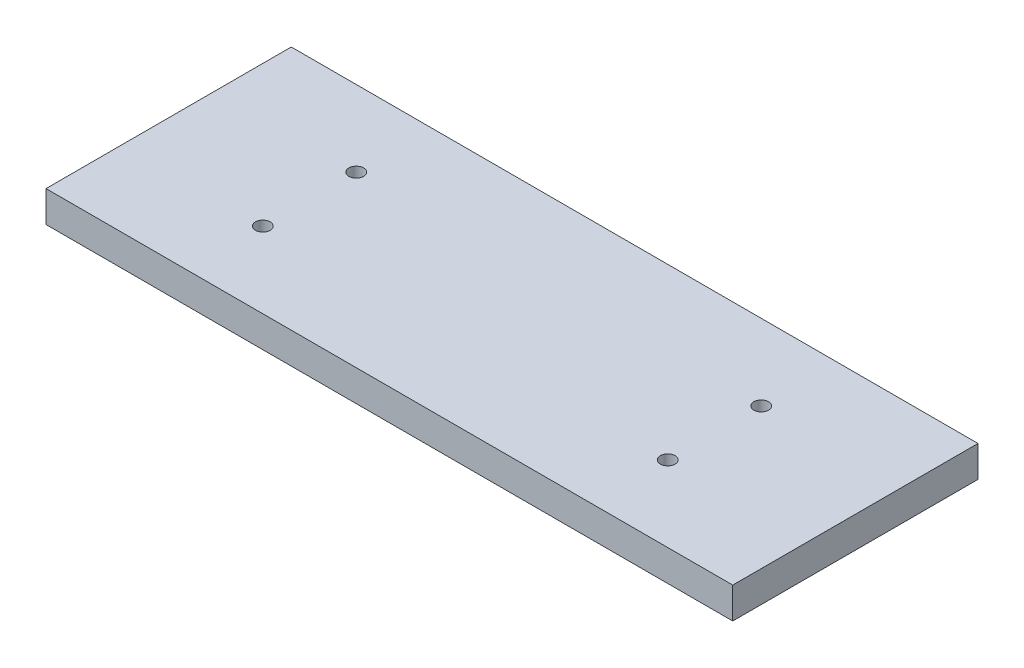
from build123d import *

# Parameters (mm, degrees)
SKETCH1_W           = 140
SKETCH1_H           = 50
BOSS_EXTRUDE1_DEPTH = 6.35
SKETCH2_R           = 1.5
CUT_EXTRUDE1_DEPTH  = 6.35


with BuildPart() as part:
    # Sketch1 → Boss-Extrude1 (new body)
    with BuildSketch(Plane(origin=(0, 0, 0), x_dir=(1, 0, 0), z_dir=(0, 1, 0))):
        with Locations((6.194690265, -6.880530973)):
            Rectangle(SKETCH1_W, SKETCH1_H)
    extrude(amount=BOSS_EXTRUDE1_DEPTH)

    # Sketch2 → Cut-Extrude1 (cut)
    with BuildSketch(Plane(origin=(0, 6.35, 0), x_dir=(1, 0, 0), z_dir=(0, 1, 0))):
        with Locations(Location((-35.080309735, 2.644469027, 0), (0, 0, 270))):
            Circle(SKETCH2_R)
        with Locations(Location((-35.080309735, -16.405530973, 0), (0, 0, 270))):
            Circle(SKETCH2_R)
        with Locations(Location((47.469690265, -16.405530973, 0), (0, 0, 270))):
            Circle(SKETCH2_R)
        with Locations(Location((47.469690265, 2.644469027, 0), (0, 0, 270))):
            Circle(SKETCH2_R)
    extrude(amount=-CUT_EXTRUDE1_DEPTH, mode=Mode.SUBTRACT)


solid = part.part
